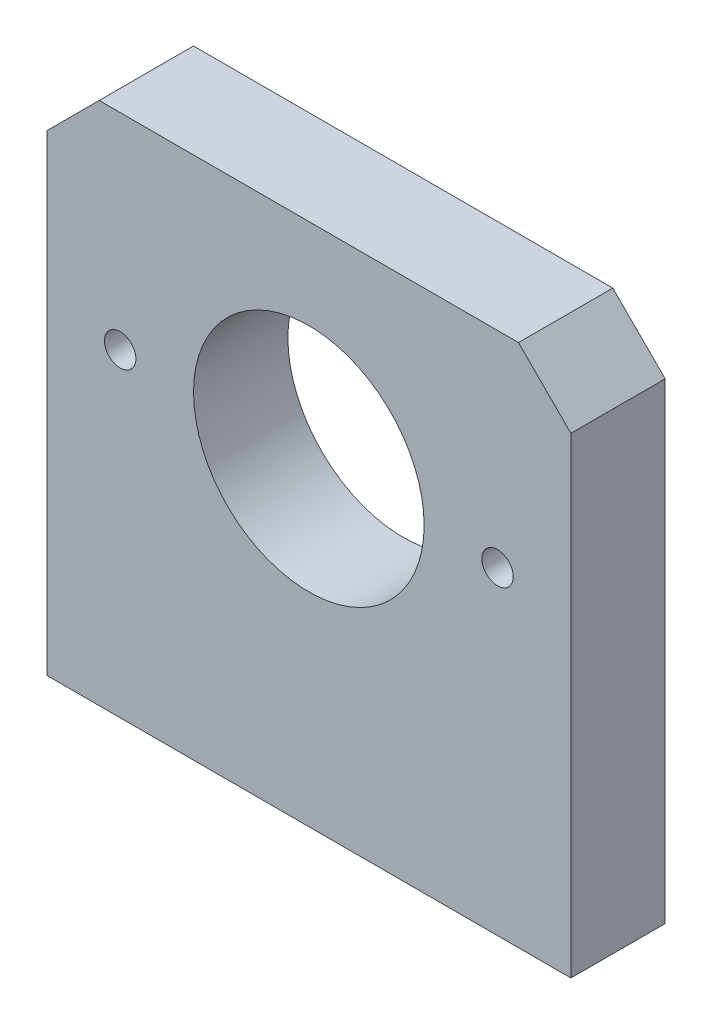
from build123d import *

# Parameters (mm, degrees)
SKETCH1_R           = 11
SKETCH1_R_2         = 1.5
BOSS_EXTRUDE1_DEPTH = 9


with BuildPart() as part:
    # Sketch1 → Boss-Extrude1 (new body)
    with BuildSketch(Plane.XY):
        Polygon((0, 0), (50, 0), (50, 45), (45, 50), (5, 50), (0, 45), align=None)
        with Locations((25, 30.4)):
            Circle(SKETCH1_R, mode=Mode.SUBTRACT)
        with Locations((7, 30.4)):
            Circle(SKETCH1_R_2, mode=Mode.SUBTRACT)
        with Locations(Location((43, 30.4, 0), (0, 0, 180))):
            Circle(SKETCH1_R_2, mode=Mode.SUBTRACT)
    extrude(amount=BOSS_EXTRUDE1_DEPTH)


solid = part.part
